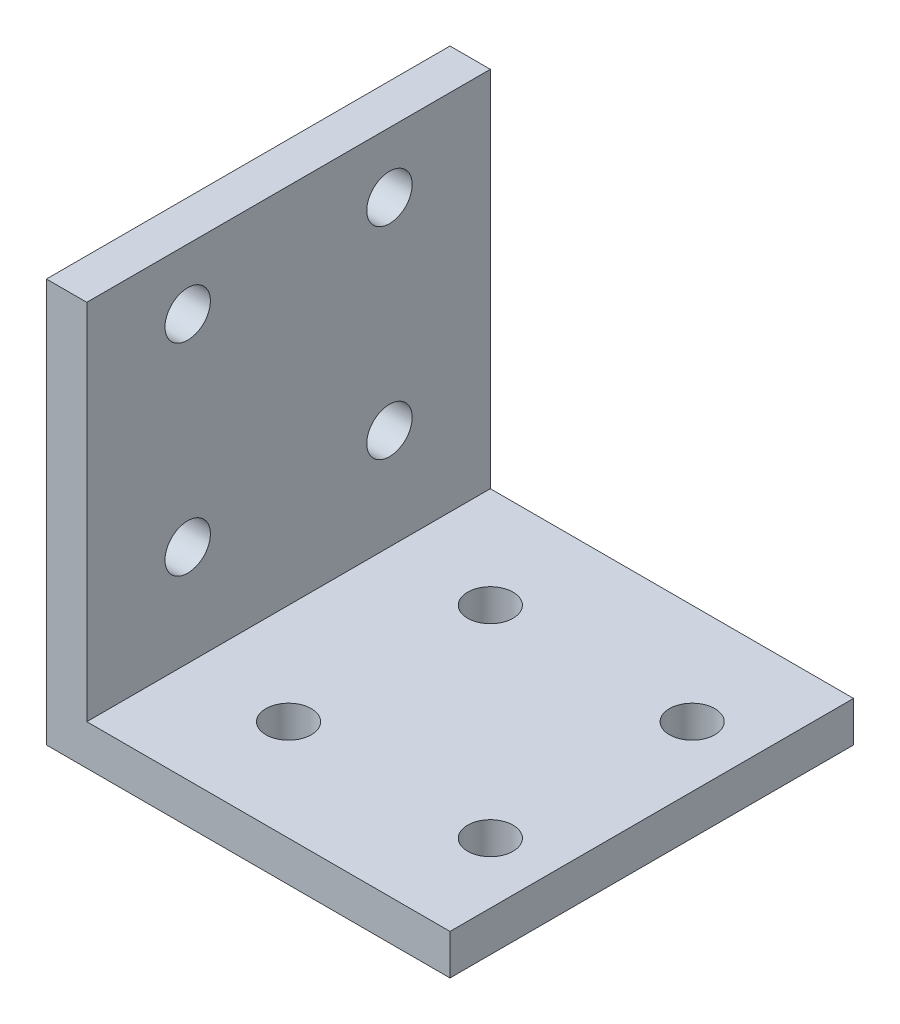
from build123d import *

# Parameters (mm, degrees)
EXTRUDE_1_DEPTH       = 40
HOLE_WIZARD_M41_D     = 4.5
HOLE_WIZARD_M41_DEPTH = 5
HOLE_WIZARD_M41_TIP   = 1.351936393
HOLE_WIZARD_M42_D     = 4.5
HOLE_WIZARD_M42_DEPTH = 5
HOLE_WIZARD_M42_TIP   = 1.351936393


with BuildPart() as part:
    # Эскиз1 → Бобышка-Вытянуть1 (new body)
    with BuildSketch(Plane.XY):
        Polygon((0, 0), (0, 40), (4, 40), (4, 4), (40, 4), (40, 0), align=None)
    extrude(amount=EXTRUDE_1_DEPTH)

    # Отверстие с зазором M41
    with Locations(Plane(origin=(0, 4, 0), x_dir=(-1, 0, 0), z_dir=(0, 1, 0))):
        with Locations((-34, 10), (-14, 10), (-34, 30), (-14, 30)):
            Hole(HOLE_WIZARD_M41_D / 2, depth=HOLE_WIZARD_M41_DEPTH)
            with Locations((0, 0, -(HOLE_WIZARD_M41_DEPTH + HOLE_WIZARD_M41_TIP / 2))):  # 118° drill point
                Cone(0, HOLE_WIZARD_M41_D / 2, HOLE_WIZARD_M41_TIP, mode=Mode.SUBTRACT)

    # Отверстие с зазором M42
    with Locations(Plane(origin=(4, 0, 0), x_dir=(0, 0, -1), z_dir=(1, 0, 0))):
        with Locations((-10, 34), (-30, 34), (-10, 14), (-30, 14)):
            Hole(HOLE_WIZARD_M42_D / 2, depth=HOLE_WIZARD_M42_DEPTH)
            with Locations((0, 0, -(HOLE_WIZARD_M42_DEPTH + HOLE_WIZARD_M42_TIP / 2))):  # 118° drill point
                Cone(0, HOLE_WIZARD_M42_D / 2, HOLE_WIZARD_M42_TIP, mode=Mode.SUBTRACT)


solid = part.part
